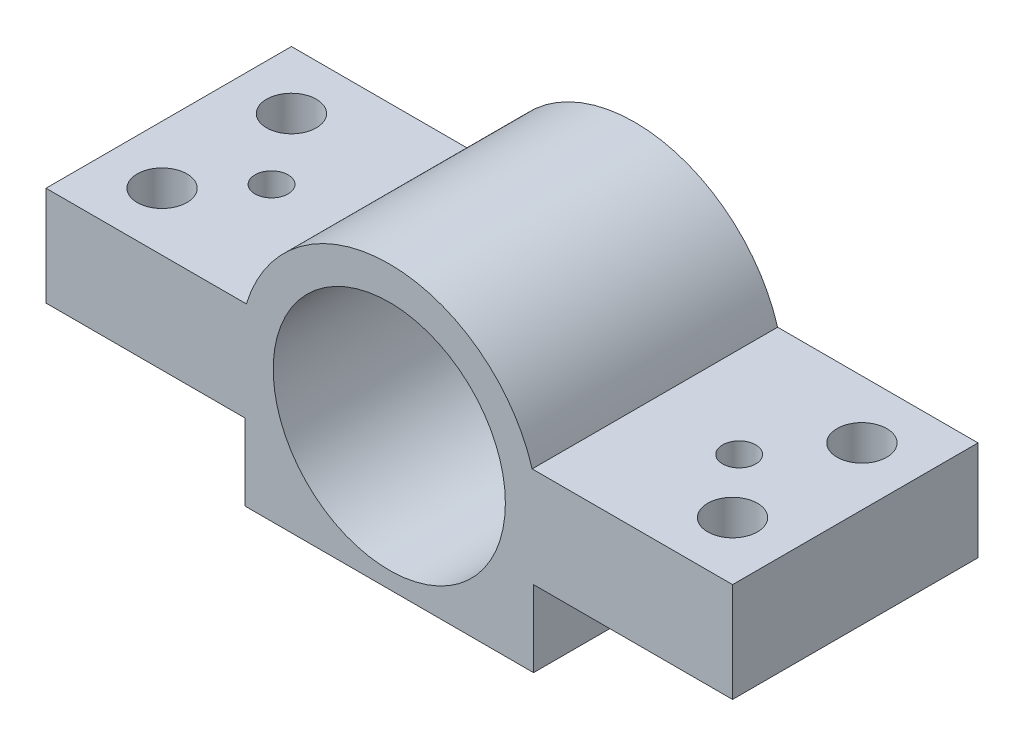
from build123d import *

# Parameters (mm, degrees)
SKETCH_3_R          = 35
EXTRUDE_2_DEPTH     = 74
SKETCH_4_R          = 7.5
SKETCH_4_R_2        = 5
CUT_EXTRUDE_1_DEPTH = 138.830511861


with BuildPart() as part:
    # 草图3 → 凸台-拉伸2 (new body)
    with BuildSketch(Plane.XY):
        with BuildLine():
            Line((-43.5, 0), (43.5, 0))
            Line((43.5, 0), (43.5, 23))
            Line((43.5, 23), (103.5, 23))
            Line((103.5, 23), (103.5, 53))
            Line((103.5, 53), (43.081318457, 53))
            ThreePointArc((43.081318457, 53), (0, 85), (-43.081318457, 53))
            Line((-43.081318457, 53), (-103.5, 53))
            Line((-103.5, 53), (-103.5, 23))
            Line((-103.5, 23), (-43.5, 23))
            Line((-43.5, 23), (-43.5, 0))
        make_face()
        with Locations((0, 40)):
            Circle(SKETCH_3_R, mode=Mode.SUBTRACT)
    extrude(amount=EXTRUDE_2_DEPTH)

    # 草图4 → 切除-拉伸1 (cut, through all)
    with BuildSketch(Plane(origin=(0, 53, 0), x_dir=(1, 0, 0), z_dir=(0, 1, 0))):
        with Locations(Location((86, -17.5, 0), (0, 0, 270))):
            Circle(SKETCH_4_R)
        with Locations(Location((86, -56.5, 0), (0, 0, 270))):
            Circle(SKETCH_4_R)
        with Locations(Location((70.5, -39, 0), (0, 0, 270))):
            Circle(SKETCH_4_R_2)
        with Locations(Location((-86, -17.5, 0), (0, 0, 270))):
            Circle(SKETCH_4_R)
        with Locations(Location((-86, -56.5, 0), (0, 0, 270))):
            Circle(SKETCH_4_R)
        with Locations(Location((-70.5, -39, 0), (0, 0, 270))):
            Circle(SKETCH_4_R_2)
    extrude(amount=-CUT_EXTRUDE_1_DEPTH, mode=Mode.SUBTRACT)


solid = part.part
